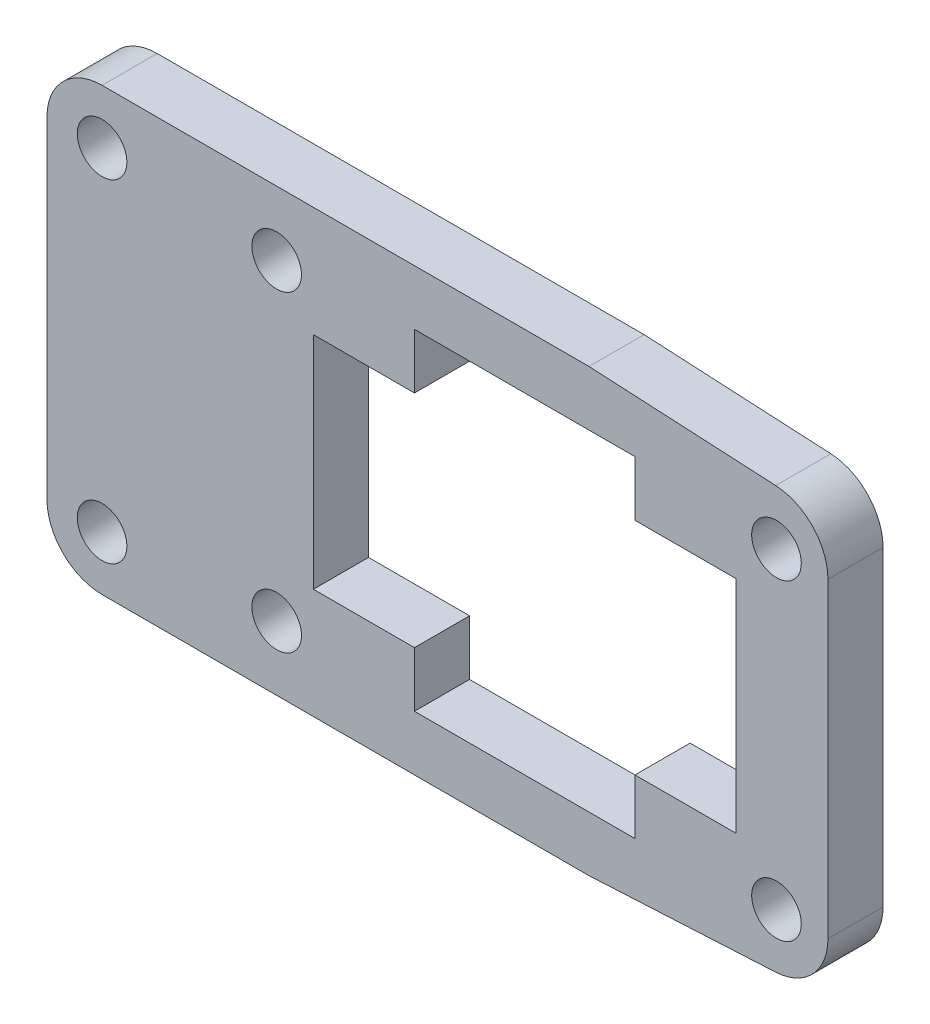
from build123d import *

# Parameters (mm, degrees)
SKETCH_1_R      = 1.35
EXTRUDE_1_DEPTH = 3


with BuildPart() as part:
    # 草图1 → 凸台-拉伸1 (new body)
    with BuildSketch(Plane(origin=(0, 0, 0), x_dir=(-1, 0, 0), z_dir=(0, 0, -1))):
        with BuildLine():
            Line((15.657318156, 3), (15.657318156, 20.9998))
            ThreePointArc((15.657318156, 20.9998), (14.7786385, 23.121120344), (12.657318156, 23.9998))
            Line((12.657318156, 23.9998), (-13.843681844, 23.9998))
            Line((-13.843681844, 23.9998), (-24.001092054, 23.467804703))
            ThreePointArc((-24.001092054, 23.467804703), (-26.020271299, 22.537010177), (-26.844181844, 20.471910982))
            Line((-26.844181844, 20.471910982), (-26.844181844, 3.528889024))
            ThreePointArc((-26.844181844, 3.528889024), (-26.020372671, 1.463896655), (-24.001386189, 0.533010723))
            Line((-24.001386189, 0.533010723), (-13.843681844, 0))
            Line((-13.843681844, 0), (12.657318156, 0))
            ThreePointArc((12.657318156, 0), (14.7786385, 0.878679656), (15.657318156, 3))
        make_face()
        with Locations(Location((-24.044031844, 3.501148349, 0), (0, 0, 180))):
            Circle(SKETCH_1_R, mode=Mode.SUBTRACT)
        with Locations(Location((-24.044031844, 20.498351651, 0), (0, 0, 180))):
            Circle(SKETCH_1_R, mode=Mode.SUBTRACT)
        with Locations(Location((3.156018156, 20.498351651, 0), (0, 0, 180))):
            Circle(SKETCH_1_R, mode=Mode.SUBTRACT)
        with Locations(Location((3.156018156, 3.501148349, 0), (0, 0, 180))):
            Circle(SKETCH_1_R, mode=Mode.SUBTRACT)
        with Locations(Location((12.657468156, 2.95, 0), (0, 0, 180))):
            Circle(SKETCH_1_R, mode=Mode.SUBTRACT)
        with Locations(Location((12.657468156, 21.049, 0), (0, 0, 180))):
            Circle(SKETCH_1_R, mode=Mode.SUBTRACT)
        Polygon((-4.343381844, 20.9998), (-4.343381844, 17.9998), (1.156518156, 17.9998), (1.156518156, 6), (-4.343381844, 6), (-4.343381844, 3), (-16.343381844, 3), (-16.343381844, 6), (-21.843181844, 6), (-21.843181844, 17.9998), (-16.343381844, 17.9998), (-16.343381844, 20.9998), align=None, mode=Mode.SUBTRACT)
    extrude(amount=-EXTRUDE_1_DEPTH)


solid = part.part
